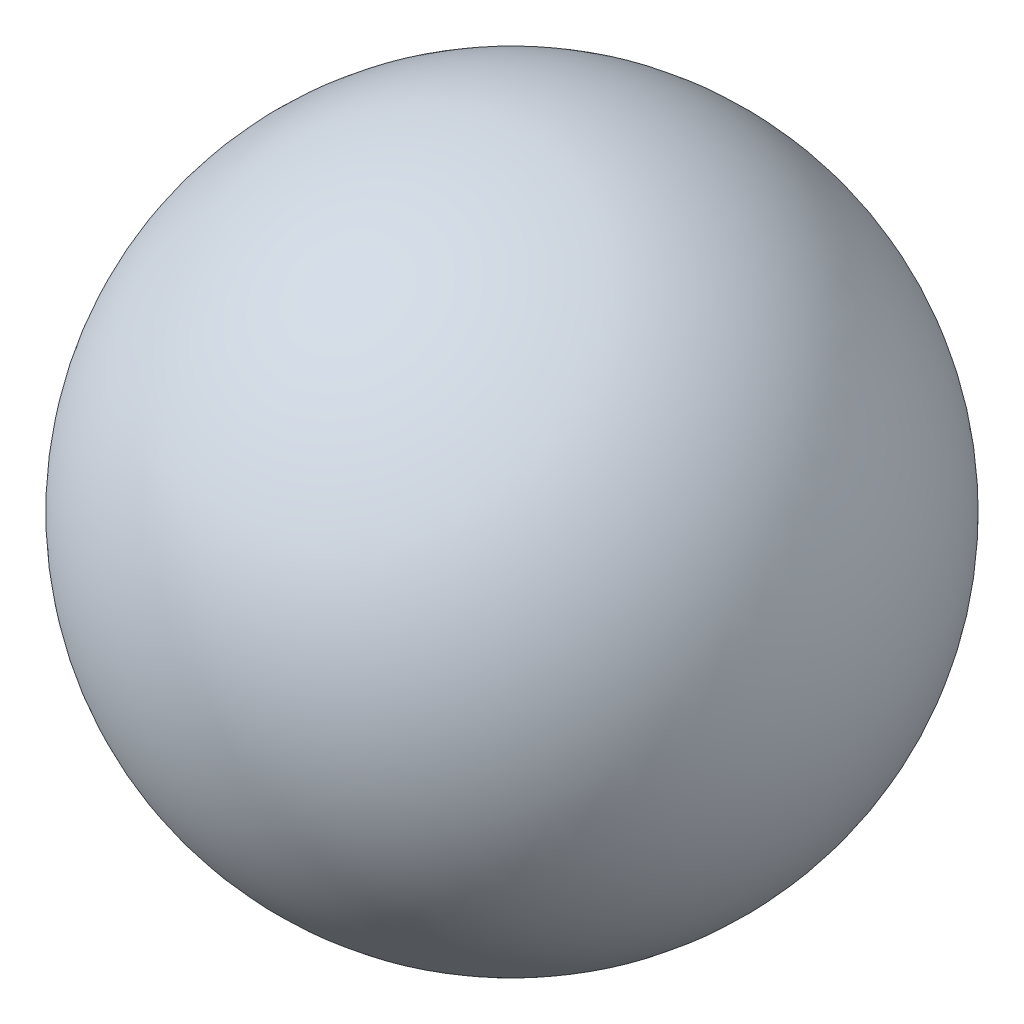
from build123d import *


with BuildPart() as part:
    # Sketch1 → Revolve1 (revolve)
    with BuildSketch(Plane.XY):
        with BuildLine():
            Line((0, 0), (0, 50))
            ThreePointArc((0, 50), (-25, 25), (0, 0))
        make_face()
    revolve(axis=Axis((0, 0, 0), (0, 1, 0)))


solid = part.part
